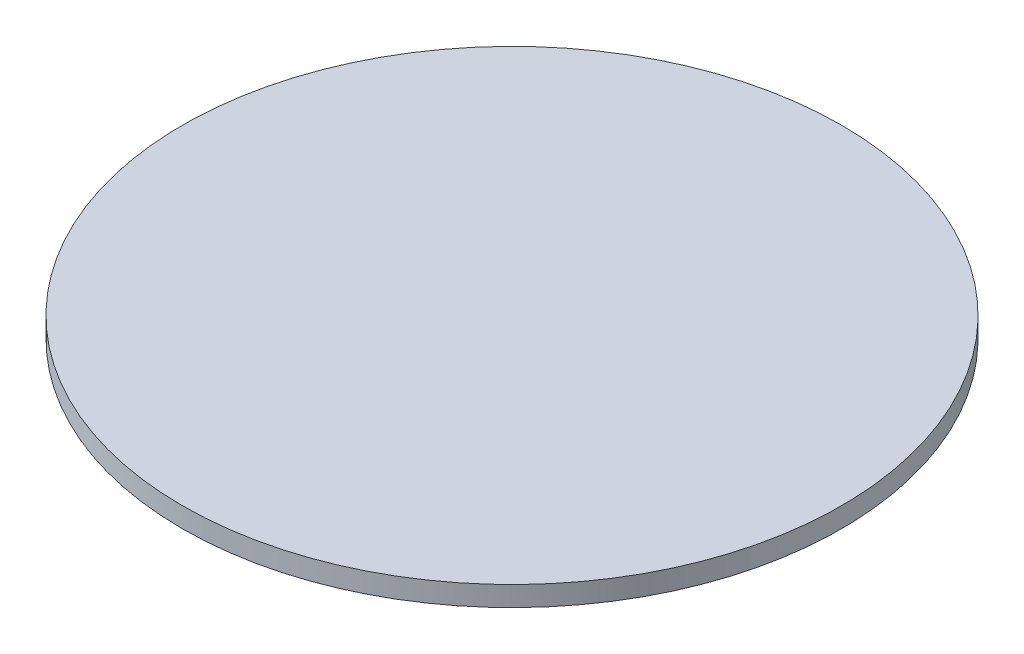
from build123d import *

# Parameters (mm, degrees)
SKETCH1_R           = 41.856787283
BOSS_EXTRUDE1_DEPTH = 2.54


with BuildPart() as part:
    # Sketch1 → Boss-Extrude1 (new body)
    with BuildSketch(Plane(origin=(0, 0, 0), x_dir=(1, 0, 0), z_dir=(0, 1, 0))):
        with Locations(Location((0, 0, 0), (0, 0, 270))):
            Circle(SKETCH1_R)
    extrude(amount=BOSS_EXTRUDE1_DEPTH)


solid = part.part
